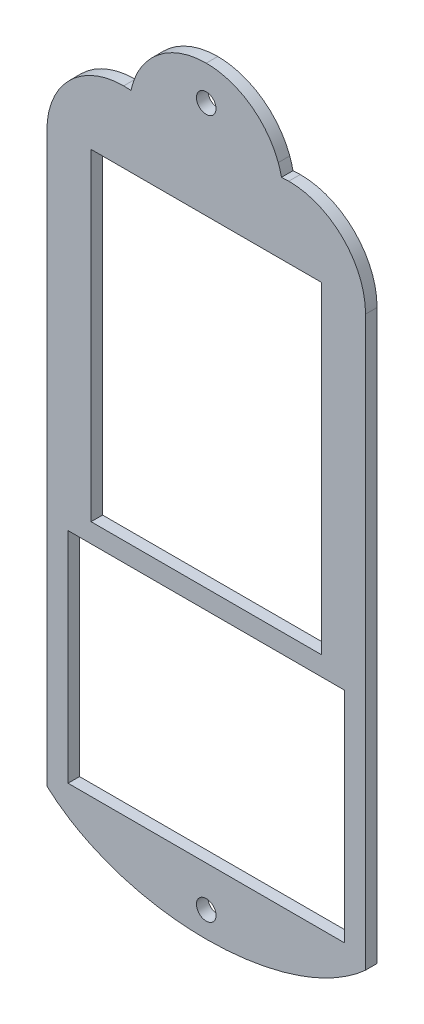
from build123d import *

# Parameters (mm, degrees)
SKETCH_1_R      = 2.55
SKETCH_1_W      = 60
SKETCH_1_H      = 84
SKETCH_1_W_2    = 72
SKETCH_1_H_2    = 57
EXTRUDE_1_DEPTH = 3


with BuildPart() as part:
    # 草图1 → 凸台-拉伸1 (new body)
    with BuildSketch(Plane.XY):
        with BuildLine():
            Line((-84.749966119, 68.150894314), (-84.749966119, -79.849105686))
            add(Edge.make_bspline(
                [(-84.749966119, -79.849105686), (-81.638463536, -82.692493713), (-77.817874174, -85.197228854), (-73.446952341, -87.268032686)],
                knots=[11, 11, 11, 11, 12, 12, 12, 12], degree=3))
            add(Edge.make_bspline(
                [(-73.446952341, -87.268032686), (-65.029679733, -91.257948491), (-54.573341235, -93.618032685), (-43.249183184, -93.618032685)],
                knots=[12, 12, 12, 12, 13, 13, 13, 13], degree=3))
            add(Edge.make_bspline(
                [(-43.249183184, -93.618032685), (-31.925025133, -93.618032685), (-21.468686634, -91.257948491), (-13.051414026, -87.268032686)],
                knots=[13, 13, 13, 13, 14, 14, 14, 14], degree=3))
            add(Edge.make_bspline(
                [(-13.051414026, -87.268032686), (-8.680492193, -85.197228854), (-4.859902832, -82.692493713), (-1.748400249, -79.849105686)],
                knots=[14, 14, 14, 14, 15, 15, 15, 15], degree=3))
            Line((-1.748400249, -79.849105686), (-1.748400249, 68.150894314))
            add(Edge.make_bspline(
                [(-1.748400249, 68.150894314), (-1.748400249, 79.196365672), (-10.701901969, 88.149867392), (-21.747373327, 88.149867392)],
                knots=[0, 0, 0, 0, 1, 1, 1, 1], degree=3))
            add(Edge.make_bspline(
                [(-21.747373327, 88.149867392), (-22.389431466, 88.149867392), (-23.027958383, 88.11812945), (-23.655913162, 88.058141725)],
                knots=[1, 1, 1, 1, 2, 2, 2, 2], degree=3))
            add(Edge.make_bspline(
                [(-23.655913162, 88.058141725), (-23.86050877, 89.056508865), (-24.142748218, 90.030178976), (-24.48846355, 90.972089614)],
                knots=[2, 2, 2, 2, 3, 3, 3, 3], degree=3))
            add(Edge.make_bspline(
                [(-24.48846355, 90.972089614), (-27.310685771, 98.592102531), (-34.644928018, 104.024867388), (-43.249183184, 104.024867388)],
                knots=[3, 3, 3, 3, 4, 4, 4, 4], degree=3))
            add(Edge.make_bspline(
                [(-43.249183184, 104.024867388), (-51.853438349, 104.024867388), (-59.187680596, 98.592102531), (-62.009902817, 90.972089614)],
                knots=[4, 4, 4, 4, 5, 5, 5, 5], degree=3))
            add(Edge.make_bspline(
                [(-62.009902817, 90.972089614), (-62.355639681, 90.030178976), (-62.637857597, 89.056508865), (-62.842453205, 88.058141725)],
                knots=[5, 5, 5, 5, 6, 6, 6, 6], degree=3))
            add(Edge.make_bspline(
                [(-62.842453205, 88.058141725), (-63.470407985, 88.11812945), (-64.105403678, 88.149867392), (-64.747461817, 88.149867392)],
                knots=[6, 6, 6, 6, 7, 7, 7, 7], degree=3))
            add(Edge.make_bspline(
                [(-64.747461817, 88.149867392), (-75.796464398, 88.149867392), (-84.749966119, 79.196365672), (-84.749966119, 68.150894314)],
                knots=[7, 7, 7, 7, 8, 8, 8, 8], degree=3))
        make_face()
        with Locations((-43.249183184, 95.010103095)):
            Circle(SKETCH_1_R, mode=Mode.SUBTRACT)
        with Locations((-43.249183184, -86.989896905)):
            Circle(SKETCH_1_R, mode=Mode.SUBTRACT)
        with Locations((-43.249183184, 27.571859125)):
            Rectangle(SKETCH_1_W, SKETCH_1_H, mode=Mode.SUBTRACT)
        with Locations((-43.249183184, -47.928140875)):
            Rectangle(SKETCH_1_W_2, SKETCH_1_H_2, mode=Mode.SUBTRACT)
    extrude(amount=EXTRUDE_1_DEPTH)


solid = part.part
